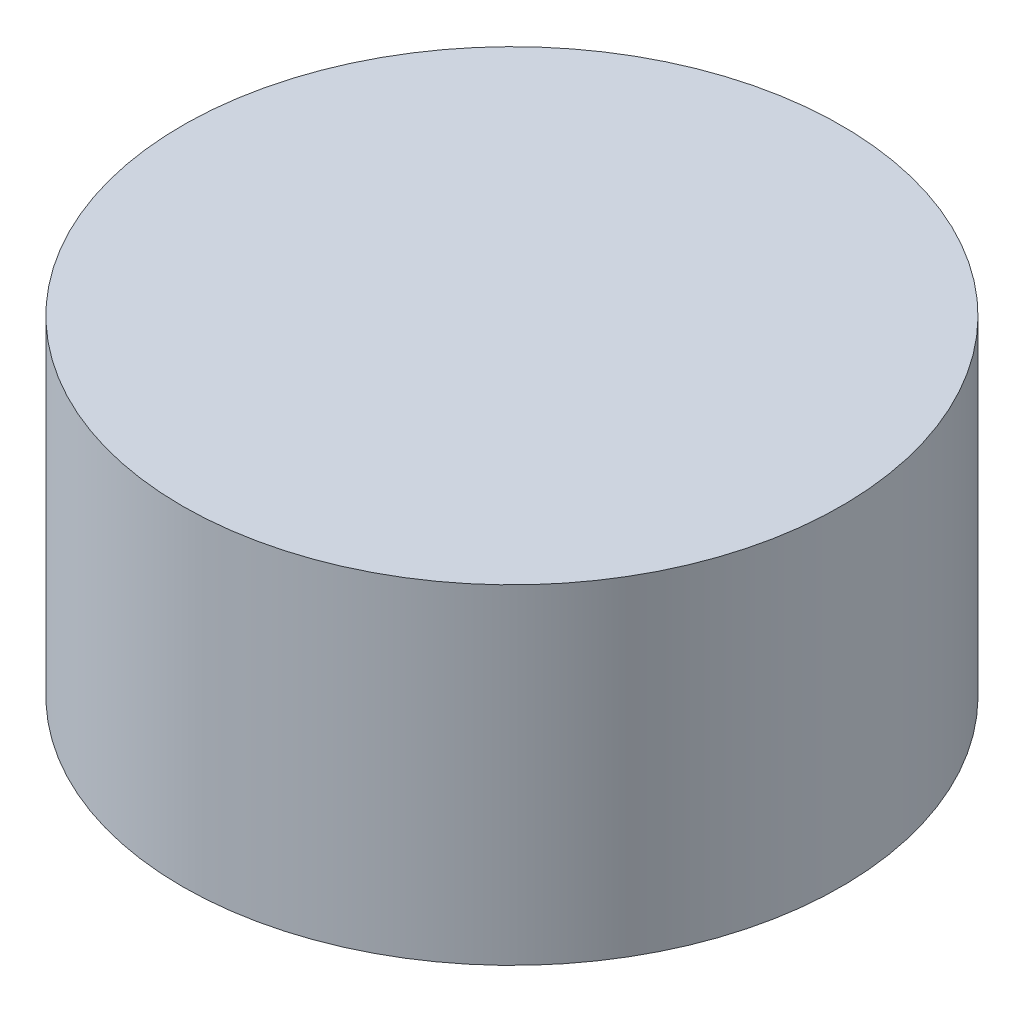
from build123d import *

# Parameters (mm, degrees)
SZKIC1_R                    = 10
DODANIE_WYCI_GNI_CIE1_DEPTH = 10


with BuildPart() as part:
    # Szkic1 → Dodanie-wyciągnięcie1 (new body)
    with BuildSketch(Plane(origin=(0, 0, 0), x_dir=(1, 0, 0), z_dir=(0, 1, 0))):
        with Locations(Location((0, 0, 0), (0, 0, 270))):
            Circle(SZKIC1_R)
    extrude(amount=DODANIE_WYCI_GNI_CIE1_DEPTH)


solid = part.part
